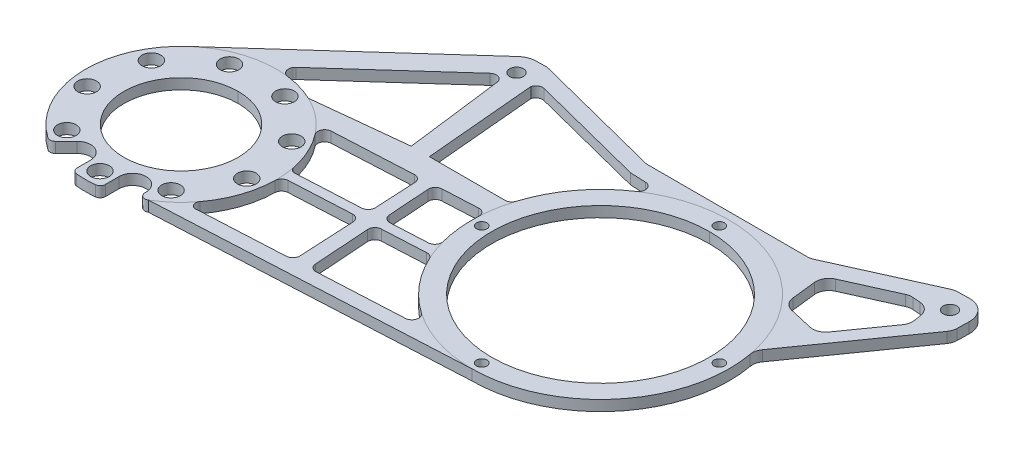
from build123d import *

# Parameters (mm, degrees)
SKETCH3_R           = 2.5
SKETCH3_R_2         = 52.3875
SKETCH3_R_3         = 3.3
SKETCH3_R_4         = 4.5
SKETCH3_R_5         = 27.4955
SKETCH3_R_6         = 3.300000004
BOSS_EXTRUDE1_DEPTH = 5.08
CUT_EXTRUDE3_REACH  = 321.397
CUT_EXTRUDE4_REACH  = 321.397
CUT_EXTRUDE5_REACH  = 321.397
CUT_EXTRUDE7_REACH  = 321.397
CUT_EXTRUDE8_REACH  = 321.397
FILLET1_R           = 6.35


with BuildPart() as part:
    # Sketch3 → Boss-Extrude1 (new body)
    with BuildSketch(Plane(origin=(0, 0, 0), x_dir=(-1, 0, 0), z_dir=(0, 1, 0))):
        with BuildLine():
            Line((-49.427109136, 17.679572239), (34.112309331, 92.818281558))
            ThreePointArc((34.112309331, 92.818281558), (49.260131818, 129.740728466), (29.825562347, 164.597881552))
            ThreePointArc((29.825562347, 164.597881552), (28.145398332, 165.051242365), (26.567761736, 164.316701751))
            Line((26.567761736, 164.316701751), (21.302878118, 159.051818133))
            ThreePointArc((21.302878118, 159.051818133), (14.21924173, 157.642795249), (10.20668404, 163.648012211))
            Line((10.20668404, 163.648012211), (10.20668404, 170.220745001))
            ThreePointArc((10.20668404, 170.220745001), (9.549518747, 171.925600851), (7.91807501, 172.748273949))
            ThreePointArc((7.91807501, 172.748273949), (3.367898451, 172.974), (-1.182278109, 172.748273949))
            ThreePointArc((-1.182278109, 172.748273949), (-2.813721846, 171.925600851), (-3.470887139, 170.220745001))
            Line((-3.470887139, 170.220745001), (-3.470887139, 163.648012211))
            ThreePointArc((-3.470887139, 163.648012211), (-9.970887139, 157.148012211), (-16.470887139, 163.648012211))
            Line((-16.470887139, 163.648012211), (-16.470887139, 164.225022653))
            ThreePointArc((-16.470887139, 164.225022653), (-17.760387302, 166.435870942), (-20.319588051, 166.401924563))
            Line((-20.319588051, 166.401924563), (-168.403592651, 158.863977372))
            Line((-168.403592651, 158.863977372), (-265.178957518, 163.648012211))
            Line((-265.178957518, 163.648012211), (-268.446360693, 19.778758396))
            ThreePointArc((-268.446360693, 19.778758396), (-265.639755471, 12.584633122), (-258.423714062, 9.834866275))
            Line((-258.423714062, 9.834866275), (-55.796807523, 15.236419982))
            ThreePointArc((-55.796807523, 15.236419982), (-52.385720802, 15.868157792), (-49.427109136, 17.679572239))
        make_face()
        with Locations(Location((-168.403592651, 39.801477371, 0), (0, 0, 90))):
            Circle(SKETCH3_R, mode=Mode.SUBTRACT)
        with Locations(Location((-225.553592651, 96.951477371, 0), (0, 0, 90))):
            Circle(SKETCH3_R, mode=Mode.SUBTRACT)
        with Locations(Location((-168.403592651, 96.951477372, 0), (0, 0, 90))):
            Circle(SKETCH3_R_2, mode=Mode.SUBTRACT)
        with Locations(Location((-111.253592651, 96.951477371, 0), (0, 0, 90))):
            Circle(SKETCH3_R, mode=Mode.SUBTRACT)
        with Locations(Location((-168.403592651, 154.101477371, 0), (0, 0, 90))):
            Circle(SKETCH3_R, mode=Mode.SUBTRACT)
        with Locations(Location((-55.796807523, 24.761419982, 0), (0, 0, 90))):
            Circle(SKETCH3_R_3, mode=Mode.SUBTRACT)
        with Locations(Location((28.436615228, 156.875733282, 0), (0, 0, 90))):
            Circle(SKETCH3_R_4, mode=Mode.SUBTRACT)
        with Locations(Location((-9.970887139, 90.351987789, 0), (0, 0, 90))):
            Circle(SKETCH3_R_4, mode=Mode.SUBTRACT)
        with Locations(Location((16.70668404, 90.351987789, 0), (0, 0, 90))):
            Circle(SKETCH3_R_4, mode=Mode.SUBTRACT)
        with Locations(Location((-30.407092297, 107.5, 0), (0, 0, 90))):
            Circle(SKETCH3_R_4, mode=Mode.SUBTRACT)
        with Locations(Location((37.142889198, 107.5, 0), (0, 0, 90))):
            Circle(SKETCH3_R_4, mode=Mode.SUBTRACT)
        with Locations(Location((3.367898451, 127, 0), (0, 0, 90))):
            Circle(SKETCH3_R_5, mode=Mode.SUBTRACT)
        with Locations(Location((-35.039603917, 133.772278929, 0), (0, 0, 90))):
            Circle(SKETCH3_R_4, mode=Mode.SUBTRACT)
        with Locations(Location((41.775400818, 133.772278929, 0), (0, 0, 90))):
            Circle(SKETCH3_R_4, mode=Mode.SUBTRACT)
        with Locations(Location((-21.700818327, 156.875733282, 0), (0, 0, 90))):
            Circle(SKETCH3_R_4, mode=Mode.SUBTRACT)
        with Locations(Location((3.367898451, 166, 0), (0, 0, 90))):
            Circle(SKETCH3_R_4, mode=Mode.SUBTRACT)
        with Locations(Location((-258.931181349, 19.346338398, 0), (0, 0, 90))):
            Circle(SKETCH3_R_6, mode=Mode.SUBTRACT)
    extrude(amount=BOSS_EXTRUDE1_DEPTH)

    # Sketch12 → Cut-Extrude3 (cut, up to next)
    with BuildSketch(Plane(origin=(0, 5.08, 0), x_dir=(1, 0, 0), z_dir=(0, 1, 0)), mode=Mode.PRIVATE) as cut_extrude3_sk1:
        with BuildLine():
            Line((265.178957518, -163.648012211), (267.97556459, -40.508702148))
            Line((267.97556459, -40.508702148), (230.316092651, -96.951477372))
            ThreePointArc((230.316092651, -96.951477372), (212.182341242, -140.730225962), (168.403592651, -158.863977372))
            Line((168.403592651, -158.863977372), (265.178957518, -163.648012211))
        make_face()
    cut_extrude3_tool1 = extrude(cut_extrude3_sk1.sketch, amount=-CUT_EXTRUDE3_REACH, mode=Mode.PRIVATE) & part.part
    # Sketch12 → Cut-Extrude3 (cut, up to next)
    with BuildSketch(Plane(origin=(0, 5.08, 0), x_dir=(1, 0, 0), z_dir=(0, 1, 0)), mode=Mode.PRIVATE) as cut_extrude3_sk2:
        with BuildLine():
            Line((267.97556459, -40.508702148), (268.273601144, -27.385651725))
            Line((268.273601144, -27.385651725), (228.792351717, -83.300271022))
            ThreePointArc((228.792351717, -83.300271022), (229.933978242, -90.083486013), (230.316092651, -96.951477372))
            Line((230.316092651, -96.951477372), (267.97556459, -40.508702148))
        make_face()
    cut_extrude3_tool2 = extrude(cut_extrude3_sk2.sketch, amount=-CUT_EXTRUDE3_REACH, mode=Mode.PRIVATE) & part.part
    add(cut_extrude3_tool1.solids().sort_by_distance((242.898488, 5.08, 120.934583))[0], mode=Mode.SUBTRACT)
    add(cut_extrude3_tool2.solids().sort_by_distance((248.238841, 5.08, 62.857625))[0], mode=Mode.SUBTRACT)

    # Sketch13 → Cut-Extrude4 (cut, up to next)
    with BuildSketch(Plane(origin=(0, 5.08, 0), x_dir=(1, 0, 0), z_dir=(0, 1, 0)), mode=Mode.PRIVATE) as cut_extrude4_sk1:
        Polygon((203.83327128, -31.548799417), (251.718937312, -10.013599753), (60.814888047, -15.102649833), (125.043218003, -31.548799417), align=None)
    cut_extrude4_tool1 = extrude(cut_extrude4_sk1.sketch, amount=-CUT_EXTRUDE4_REACH, mode=Mode.PRIVATE) & part.part
    add(cut_extrude4_tool1.solids().sort_by_distance((161.52534, 5.08, 20.689871))[0], mode=Mode.SUBTRACT)

    # Sketch14 → Cut-Extrude5 (cut, up to next)
    with BuildSketch(Plane(origin=(0, 5.08, 0), x_dir=(1, 0, 0), z_dir=(0, 1, 0)), mode=Mode.PRIVATE) as cut_extrude5_sk1:
        with BuildLine():
            Line((239.024215296, -57.659173825), (253.658137658, -36.934140814))
            ThreePointArc((253.658137658, -36.934140814), (254.650790818, -34.73148992), (254.748854263, -32.317486022))
            Line((254.748854263, -32.317486022), (254.202478841, -28.721859784))
            ThreePointArc((254.202478841, -28.721859784), (252.246840617, -25.023916895), (248.415397328, -23.344826428))
            Line((248.415397328, -23.344826428), (244.789377516, -23.063695738))
            ThreePointArc((244.789377516, -23.063695738), (243.207807499, -23.139071835), (241.694052718, -23.603390409))
            Line((241.694052718, -23.603390409), (218.555439905, -34.009315359))
            ThreePointArc((218.555439905, -34.009315359), (215.642030878, -36.658093579), (214.850244325, -40.515171783))
            Line((214.850244325, -40.515171783), (216.162388213, -52.101741658))
            ThreePointArc((216.162388213, -52.101741658), (217.735718318, -55.616800534), (221.05111963, -57.576167948))
            Line((221.05111963, -57.576167948), (232.416061427, -60.185463062))
            ThreePointArc((232.416061427, -60.185463062), (236.104541247, -59.927822237), (239.024215296, -57.659173825))
        make_face()
    cut_extrude5_tool1 = extrude(cut_extrude5_sk1.sketch, amount=-CUT_EXTRUDE5_REACH, mode=Mode.PRIVATE) & part.part
    add(cut_extrude5_tool1.solids().sort_by_distance((234.242502, 5.08, 41.374423))[0], mode=Mode.SUBTRACT)

    # Sketch16 → Cut-Extrude7 (cut, up to next)
    with BuildSketch(Plane(origin=(0, 5.08, 0), x_dir=(1, 0, 0), z_dir=(0, 1, 0)), mode=Mode.PRIVATE) as cut_extrude7_sk1:
        with BuildLine():
            ThreePointArc((69.046245626, -24.727750323), (66.542546074, -25.08661128), (65.027273865, -27.111763809))
            Line((65.027273865, -27.111763809), (69.836897349, -80.726147549))
            Line((69.836897349, -80.726147549), (104.902932966, -80.726147549))
            Line((104.902932966, -80.726147549), (106.181294396, -80.726147549))
            ThreePointArc((106.181294396, -80.726147549), (108.135575875, -80.085723755), (109.33179051, -78.41287311))
            ThreePointArc((109.33179051, -78.41287311), (118.900577331, -59.768024998), (134.141275498, -45.383548584))
            ThreePointArc((134.141275498, -45.383548584), (135.491747028, -41.736140201), (132.433270999, -39.333415574))
            Line((132.433270999, -39.333415574), (125.043218003, -39.066198553))
            Line((125.043218003, -39.066198553), (69.046245626, -24.727750323))
        make_face()
    cut_extrude7_tool1 = extrude(cut_extrude7_sk1.sketch, amount=-CUT_EXTRUDE7_REACH, mode=Mode.PRIVATE) & part.part
    # Sketch16 → Cut-Extrude7 (cut, up to next)
    with BuildSketch(Plane(origin=(0, 5.08, 0), x_dir=(1, 0, 0), z_dir=(0, 1, 0)), mode=Mode.PRIVATE) as cut_extrude7_sk2:
        with BuildLine():
            Line((49.664626521, -31.393934958), (0.470266897, -75.641318477))
            ThreePointArc((0.470266897, -75.641318477), (-0.471425182, -79.08712772), (2.273262732, -81.373407135))
            ThreePointArc((2.273262732, -81.373407135), (9.494503836, -82.861951976), (16.384923505, -85.48572895))
            Line((16.384923505, -85.48572895), (61.119181788, -80.726147549))
            Line((61.119181788, -80.726147549), (55.174788623, -33.848786392))
            ThreePointArc((55.174788623, -33.848786392), (53.21654985, -30.832767661), (49.664626521, -31.393934958))
        make_face()
    cut_extrude7_tool2 = extrude(cut_extrude7_sk2.sketch, amount=-CUT_EXTRUDE7_REACH, mode=Mode.PRIVATE) & part.part
    add(cut_extrude7_tool1.solids().sort_by_distance((93.414384, 5.08, 53.604696))[0], mode=Mode.SUBTRACT)
    add(cut_extrude7_tool2.solids().sort_by_distance((36.14539, 5.08, 64.371233))[0], mode=Mode.SUBTRACT)

    # Sketch17 → Cut-Extrude8 (cut, up to next)
    with BuildSketch(Plane(origin=(0, 5.08, 0), x_dir=(1, 0, 0), z_dir=(0, 1, 0)), mode=Mode.PRIVATE) as cut_extrude8_sk1:
        with BuildLine():
            Line((131.452661798, -153.869409186), (90.64299686, -155.94675103))
            ThreePointArc((90.64299686, -155.94675103), (88.285567179, -155.120661928), (87.181224228, -152.88005385))
            Line((87.181224228, -152.88005385), (85.293138328, -125.961057562))
            ThreePointArc((85.293138328, -125.961057562), (86.115404758, -123.540459697), (88.419181019, -122.432294075))
            Line((88.419181019, -122.432294075), (109.206000647, -121.374178791))
            ThreePointArc((109.206000647, -121.374178791), (111.07282097, -121.840521706), (112.362712556, -123.268342959))
            ThreePointArc((112.362712556, -123.268342959), (121.136607146, -136.938847096), (133.164229527, -147.856731942))
            ThreePointArc((133.164229527, -147.856731942), (134.460631969, -151.475711569), (131.452661798, -153.869409186))
        make_face()
    cut_extrude8_tool1 = extrude(cut_extrude8_sk1.sketch, amount=-CUT_EXTRUDE8_REACH, mode=Mode.PRIVATE) & part.part
    # Sketch17 → Cut-Extrude8 (cut, up to next)
    with BuildSketch(Plane(origin=(0, 5.08, 0), x_dir=(1, 0, 0), z_dir=(0, 1, 0)), mode=Mode.PRIVATE) as cut_extrude8_sk2:
        with BuildLine():
            Line((103.108806839, -90.275109461), (86.223975368, -91.134601128))
            ThreePointArc((86.223975368, -91.134601128), (83.920199108, -92.24276675), (83.097932678, -94.663364615))
            Line((83.097932678, -94.663364615), (84.503583656, -114.704144256))
            ThreePointArc((84.503583656, -114.704144256), (85.607926606, -116.944752333), (87.965356288, -117.770841435))
            Line((87.965356288, -117.770841435), (105.512545009, -116.877633676))
            ThreePointArc((105.512545009, -116.877633676), (108.01073352, -115.528072439), (108.537536373, -112.737957724))
            ThreePointArc((108.537536373, -112.737957724), (106.819205366, -103.317080168), (106.574237422, -93.743910051))
            ThreePointArc((106.574237422, -93.743910051), (105.61267286, -91.239108214), (103.108806839, -90.275109461))
        make_face()
    cut_extrude8_tool2 = extrude(cut_extrude8_sk2.sketch, amount=-CUT_EXTRUDE8_REACH, mode=Mode.PRIVATE) & part.part
    # Sketch17 → Cut-Extrude8 (cut, up to next)
    with BuildSketch(Plane(origin=(0, 5.08, 0), x_dir=(1, 0, 0), z_dir=(0, 1, 0)), mode=Mode.PRIVATE) as cut_extrude8_sk3:
        with BuildLine():
            Line((80.052871844, -153.179546907), (78.681270967, -126.234259887))
            ThreePointArc((78.681270967, -126.234259887), (77.596689655, -123.951578918), (75.215675662, -123.104394525))
            Line((75.215675662, -123.104394525), (45.731963094, -124.605209342))
            ThreePointArc((45.731963094, -124.605209342), (43.527290634, -125.606361756), (42.598382473, -127.842433409))
            ThreePointArc((42.598382473, -127.842433409), (40.090774846, -141.998412958), (33.333547926, -154.687768236))
            ThreePointArc((33.333547926, -154.687768236), (33.117348121, -157.40764503), (35.490379046, -158.754194829))
            Line((35.490379046, -158.754194829), (76.923006481, -156.645142211))
            ThreePointArc((76.923006481, -156.645142211), (79.205687451, -155.5605609), (80.052871844, -153.179546907))
        make_face()
    cut_extrude8_tool3 = extrude(cut_extrude8_sk3.sketch, amount=-CUT_EXTRUDE8_REACH, mode=Mode.PRIVATE) & part.part
    # Sketch17 → Cut-Extrude8 (cut, up to next)
    with BuildSketch(Plane(origin=(0, 5.08, 0), x_dir=(1, 0, 0), z_dir=(0, 1, 0)), mode=Mode.PRIVATE) as cut_extrude8_sk4:
        with BuildLine():
            Line((78.107698609, -114.966352394), (77.086562804, -94.905999706))
            ThreePointArc((77.086562804, -94.905999706), (76.001981493, -92.623318737), (73.6209675, -91.776134344))
            Line((73.6209675, -91.776134344), (35.56397146, -93.713356579))
            ThreePointArc((35.56397146, -93.713356579), (32.734334769, -95.626100347), (33.111751104, -99.020653253))
            ThreePointArc((33.111751104, -99.020653253), (38.494245596, -107.995538108), (41.707590279, -117.955167673))
            ThreePointArc((41.707590279, -117.955167673), (42.63871913, -119.460547422), (44.327075673, -119.992168821))
            Line((44.327075673, -119.992168821), (74.977833246, -118.431947698))
            ThreePointArc((74.977833246, -118.431947698), (77.260514216, -117.347366386), (78.107698609, -114.966352394))
        make_face()
    cut_extrude8_tool4 = extrude(cut_extrude8_sk4.sketch, amount=-CUT_EXTRUDE8_REACH, mode=Mode.PRIVATE) & part.part
    add(cut_extrude8_tool1.solids().sort_by_distance((105.343886, 5.08, 140.249221))[0], mode=Mode.SUBTRACT)
    add(cut_extrude8_tool2.solids().sort_by_distance((95.519049, 5.08, 104.104227))[0], mode=Mode.SUBTRACT)
    add(cut_extrude8_tool3.solids().sort_by_distance((59.040951, 5.08, 141.665951))[0], mode=Mode.SUBTRACT)
    add(cut_extrude8_tool4.solids().sort_by_distance((57.358375, 5.08, 105.411736))[0], mode=Mode.SUBTRACT)

    # Fillet1
    fillet1_edges = [part.edges().sort_by_distance(p)[0] for p in [
        (268.273601144, 2.54, 27.385651725),
        (228.792351717, 2.54, 83.300271022),
        (125.043218003, 2.54, 31.548799417),
        (251.718937312, 2.54, 10.013599753),
        (203.83327128, 2.54, 31.548799417),
    ]]
    fillet(fillet1_edges, radius=FILLET1_R)


solid = part.part
